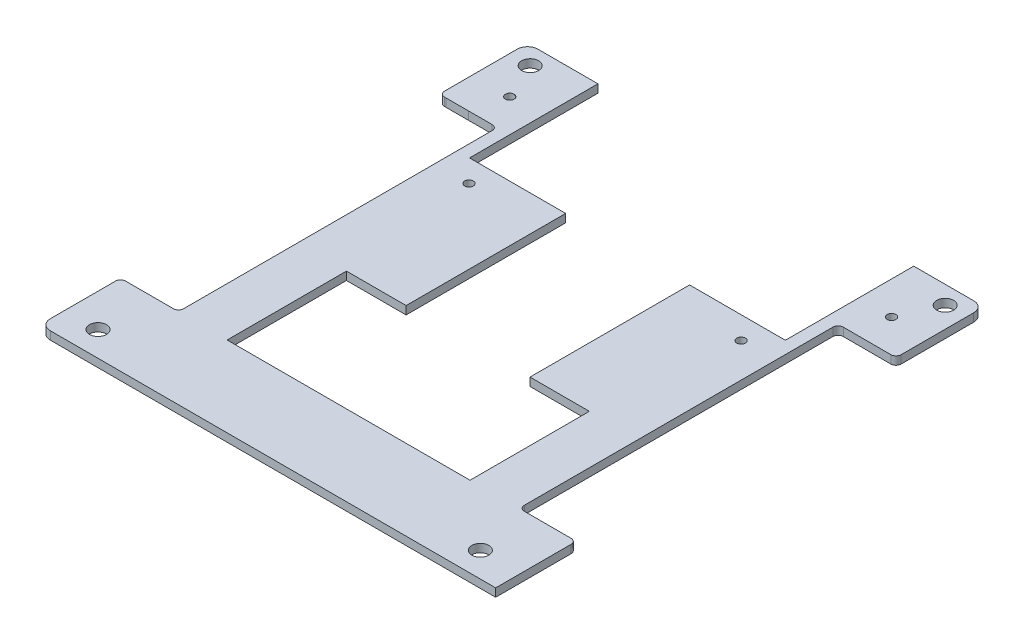
from build123d import *

# Parameters (mm, degrees)
SKETCH1_R           = 1.6383
SKETCH1_R_2         = 0.8382
BOSS_EXTRUDE1_DEPTH = 1.575


with BuildPart() as part:
    # Sketch1 → Boss-Extrude1 (new body)
    with BuildSketch(Plane(origin=(0, 0, 0), x_dir=(1, 0, 0), z_dir=(0, 1, 0))):
        with BuildLine():
            Line((-38.39500299, 29.999999735), (-42.73000299, 29.999999735))
            Line((-42.73000299, 29.999999735), (-43.011025994, 30.003097626))
            ThreePointArc((-43.011025994, 30.003097626), (-43.710996344, 30.299838092), (-44.000003042, 31.003036872))
            Line((-44.000003042, 31.003036872), (-44.000003042, 31.269999735))
            Line((-44.000003042, 31.269999735), (-44.000005679, 44.999999735))
            ThreePointArc((-44.000005679, 44.999999735), (-43.414218633, 46.414215608), (-42.000002924, 47.000003051))
            Line((-42.000002924, 47.000003051), (-30.435003, 47.000003051))
            Line((-30.435003, 47.000003051), (-30.435003, 22.255357341))
            Line((-30.435003, 22.255357341), (-11.909003, 22.255357341))
            Line((-11.909003, 22.255357341), (-11.909003, -8.5))
            Line((-11.909003, -8.5), (-23.409003, -8.5))
            Line((-23.409003, -8.5), (-23.409003, -31.499996949))
            Line((-23.409003, -31.499996949), (23.408997, -31.499996949))
            Line((23.408997, -31.499996949), (23.408997, -8.499997555))
            Line((23.408997, -8.499997555), (11.97084713, -8.499997555))
            Line((11.97084713, -8.499997555), (11.97084713, 22.255357341))
            Line((11.97084713, 22.255357341), (30.434997, 22.255357341))
            Line((30.434997, 22.255357341), (30.434997, 47.000003051))
            Line((30.434997, 47.000003051), (42.000008541, 47.000003051))
            ThreePointArc((42.000008541, 47.000003051), (43.414213215, 46.414220704), (43.999996956, 45.000016607))
            Line((43.999996956, 45.000016607), (43.999996956, 32.000003378))
            Line((43.999996956, 32.000003378), (43.999996956, 31.015615364))
            ThreePointArc((43.999996956, 31.015615364), (43.706534093, 30.307939396), (42.998386406, 30.015616661))
            Line((42.998386406, 30.015616661), (33.825607551, 30.030389905))
            ThreePointArc((33.825607551, 30.030389905), (33.117459864, 29.738067169), (32.823997, 29.030391202))
            Line((32.823997, 29.030391202), (32.823997, -30.453996949))
            ThreePointArc((32.823997, -30.453996949), (33.116890219, -31.16110373), (33.823997, -31.453996949))
            Line((33.823997, -31.453996949), (36.099999555, -31.453996949))
            Line((36.099999555, -31.453996949), (42.849728118, -31.453996949))
            ThreePointArc((42.849728118, -31.453996949), (43.556834899, -31.746890168), (43.849728118, -32.453996949))
            Line((43.849728118, -32.453996949), (43.849728118, -36.999996949))
            Line((43.849728118, -36.999996949), (43.849728118, -46.999996949))
            Line((43.849728118, -46.999996949), (-42.000000178, -46.999996949))
            ThreePointArc((-42.000000178, -46.999996949), (-43.414212804, -46.414211581), (-44.000000499, -44.999999921))
            Line((-44.000000499, -44.999999921), (-44.000000178, -38.976999921))
            Line((-44.000000178, -38.976999921), (-44.000000178, -32.453999802))
            ThreePointArc((-44.000000178, -32.453999802), (-43.70710696, -31.746893021), (-43.000000178, -31.453999802))
            Line((-43.000000178, -31.453999802), (-36.100000549, -31.453999802))
            Line((-36.100000549, -31.453999802), (-33.824003042, -31.453999802))
            ThreePointArc((-33.824003042, -31.453999802), (-33.116896261, -31.161106583), (-32.824003042, -30.453999802))
            Line((-32.824003042, -30.453999802), (-32.824003042, 29.011483943))
            ThreePointArc((-32.824003042, 29.011483943), (-33.117785331, 29.719478678), (-33.826516131, 30.011480785))
            Line((-33.826516131, 30.011480785), (-38.39500299, 29.999999735))
        make_face()
        with Locations(Location((40, 43.5, 0), (0, 0, 270))):
            Circle(SKETCH1_R, mode=Mode.SUBTRACT)
        with Locations(Location((-40, 43.5, 0), (0, 0, 270))):
            Circle(SKETCH1_R, mode=Mode.SUBTRACT)
        with Locations(Location((-37.6, -42.2, 0), (0, 0, 270))):
            Circle(SKETCH1_R, mode=Mode.SUBTRACT)
        with Locations(Location((36.1, -42.2, 0), (0, 0, 270))):
            Circle(SKETCH1_R, mode=Mode.SUBTRACT)
        with Locations(Location((-36.785003, 36.350003051, 0), (0, 0, 270))):
            Circle(SKETCH1_R_2, mode=Mode.SUBTRACT)
        with Locations(Location((-26.220003, 17.93193176, 0), (0, 0, 270))):
            Circle(SKETCH1_R_2, mode=Mode.SUBTRACT)
        with Locations(Location((26.219997, 17.93193176, 0), (0, 0, 270))):
            Circle(SKETCH1_R_2, mode=Mode.SUBTRACT)
        with Locations(Location((36.784997, 36.368003051, 0), (0, 0, 270))):
            Circle(SKETCH1_R_2, mode=Mode.SUBTRACT)
    extrude(amount=BOSS_EXTRUDE1_DEPTH)


solid = part.part
